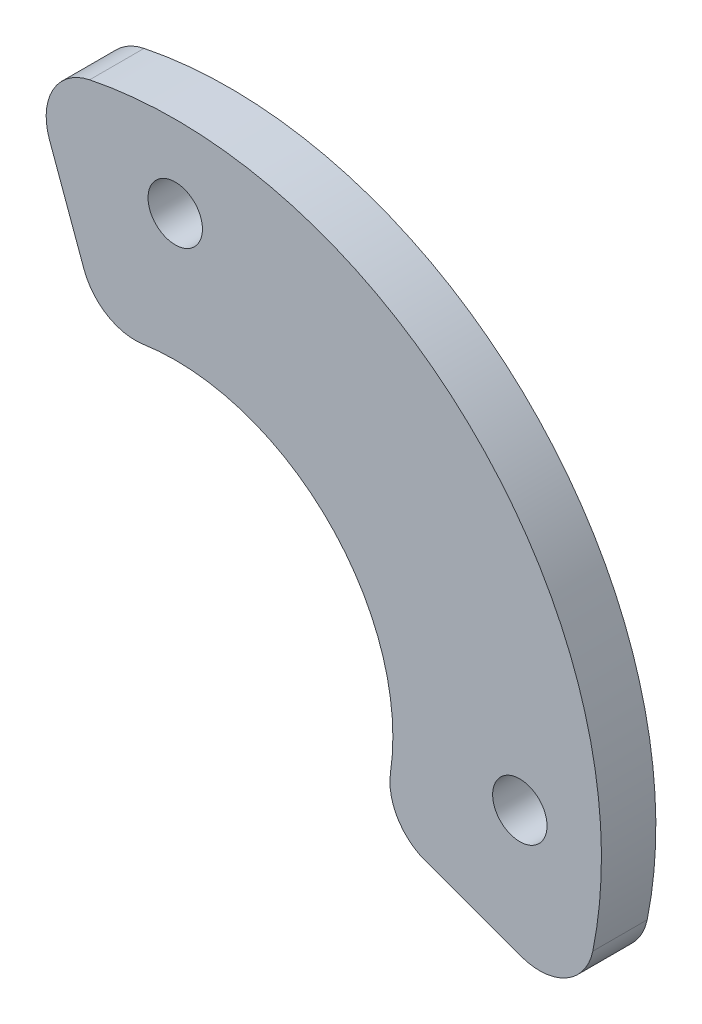
from build123d import *

# Parameters (mm, degrees)
SKETCH_1_R      = 1.5
EXTRUDE_1_DEPTH = 3
FILLET_1_R      = 3


with BuildPart() as part:
    # 草图1 → 凸台-拉伸1 (new body)
    with BuildSketch(Plane.XY):
        with BuildLine():
            Line((-8.037473368, 22.082776588), (-4.10424172, 11.276311449))
            ThreePointArc((-4.10424172, 11.276311449), (6.882917236, 9.829824531), (12, 0))
            ThreePointArc((12, 0), (11.817693036, -2.083778132), (11.276311449, -4.10424172))
            Line((11.276311449, -4.10424172), (22.082776588, -8.037473368))
            ThreePointArc((22.082776588, -8.037473368), (23.142982196, -4.080732175), (23.5, 0))
            ThreePointArc((23.5, 0), (13.479046254, 19.250073041), (-8.037473368, 22.082776588))
        make_face()
        with Locations((19, 0)):
            Circle(SKETCH_1_R, mode=Mode.SUBTRACT)
        with Locations((0, 19)):
            Circle(SKETCH_1_R, mode=Mode.SUBTRACT)
    extrude(amount=EXTRUDE_1_DEPTH)

    # 圆角1
    fillet_1_edges = [part.edges().sort_by_distance(p)[0] for p in [
        (11.276311449, -4.10424172, 1.5),
        (-4.10424172, 11.276311449, 1.5),
        (-8.037473368, 22.082776588, 1.5),
        (22.082776588, -8.037473368, 1.5),
    ]]
    fillet(fillet_1_edges, radius=FILLET_1_R)


solid = part.part
